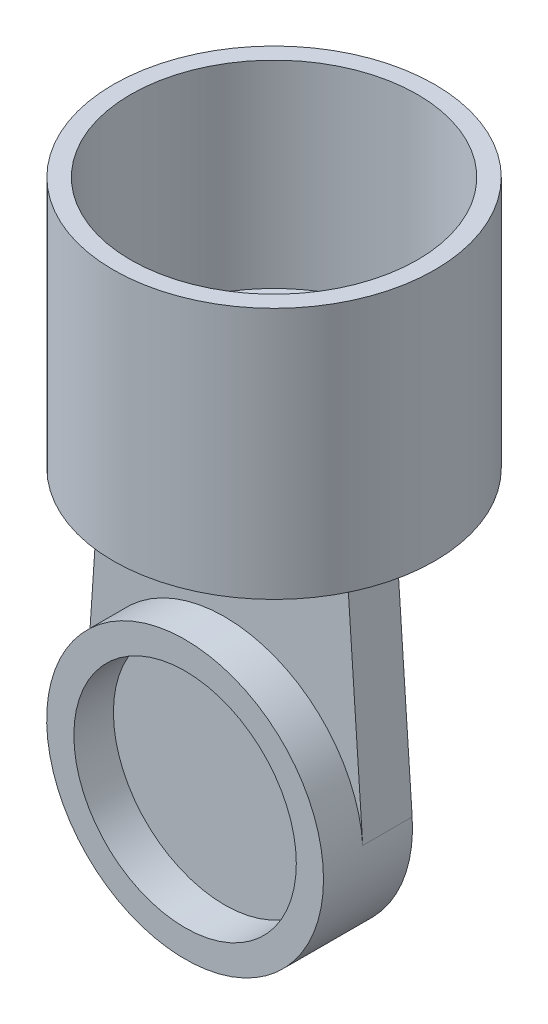
from build123d import *

# Parameters (mm, degrees)
EXTRUDE_1_DEPTH     = 10
SKETCH_2_R          = 28
SKETCH_2_R_2        = 22.5
EXTRUDE_2_DEPTH     = 8
SKETCH_3_R          = 32.5
SKETCH_3_R_2        = 29
EXTRUDE_3_DEPTH     = 40
SKETCH_4_R          = 32.5
EXTRUDE_4_DEPTH     = 11
RIB_4_REACH         = 112.057
SKETCH_5_WALL_W     = 291.205309728
SKETCH_5_WALL_H     = 8
SKETCH_6_W          = 24.014667972
SKETCH_6_H          = 9.139910945
CUT_EXTRUDE_1_DEPTH = 16


with BuildPart() as part:
    # 草图1 → 凸台-拉伸1 (new body)
    with BuildSketch(Plane.XY):
        with BuildLine():
            Line((0, 60), (-24, 60))
            Line((-24, 60), (-27.935985851, 1.892272326))
            ThreePointArc((-27.935985851, 1.892272326), (0, -28), (27.935985851, 1.892272326))
            Line((27.935985851, 1.892272326), (24, 60))
            Line((24, 60), (0, 60))
        make_face()
    extrude(amount=EXTRUDE_1_DEPTH)

    # 草图2 → 凸台-拉伸2 (add)
    with BuildSketch(Plane.XY.offset(10)):
        with Locations(Location((0, 0, 0), (0, 0, 176.124931535))):
            Circle(SKETCH_2_R)
        Circle(SKETCH_2_R_2, mode=Mode.SUBTRACT)
    extrude(amount=EXTRUDE_2_DEPTH)



with BuildPart() as body_2:
    # 草图3 → 凸台-拉伸3 (new body)
    with BuildSketch(Plane(origin=(0, 60, 0), x_dir=(1, 0, 0), z_dir=(0, 1, 0))):
        with Locations(Location((0, 0, 0), (0, 0, 270))):
            Circle(SKETCH_3_R)
        with Locations(Location((0, 0, 0), (0, 0, 270))):
            Circle(SKETCH_3_R_2, mode=Mode.SUBTRACT)
    extrude(amount=EXTRUDE_3_DEPTH)


with BuildPart() as part_1:
    add(part.part)

    add(body_2.part)  # 凸台-拉伸4 merges body 2
    # 草图4 → 凸台-拉伸4 (add)
    with BuildSketch(Plane.XZ.offset(-60)):
        with Locations(Location((0, 0, 0), (0, 0, 90))):
            Circle(SKETCH_4_R)
    extrude(amount=EXTRUDE_4_DEPTH)

    # 草图5 wall → 筋4 (add, up to next)
    with BuildSketch(Plane(origin=(0, 16.604964226, -11.999062573), x_dir=(0, 0.937740264285, -0.347337295346), z_dir=(0, 0.347337295346, 0.937740264285)), mode=Mode.PRIVATE) as rib_4_sk1:
        Rectangle(SKETCH_5_WALL_W, SKETCH_5_WALL_H)
    rib_4_tool1 = extrude(rib_4_sk1.sketch, amount=RIB_4_REACH, mode=Mode.PRIVATE) - part_1.part
    add(rib_4_tool1.solids().sort_by_distance((0, 16.604964226, -11.999062573))[0])

    # 草图6 → 切除-拉伸1 (cut)
    with BuildSketch(Plane(origin=(0, 60, 0), x_dir=(1, 0, 0), z_dir=(0, 1, 0))):
        with Locations((0, -21.281655386)):
            Rectangle(SKETCH_6_W, SKETCH_6_H)
    extrude(amount=-CUT_EXTRUDE_1_DEPTH, mode=Mode.SUBTRACT)


solid = part_1.part
